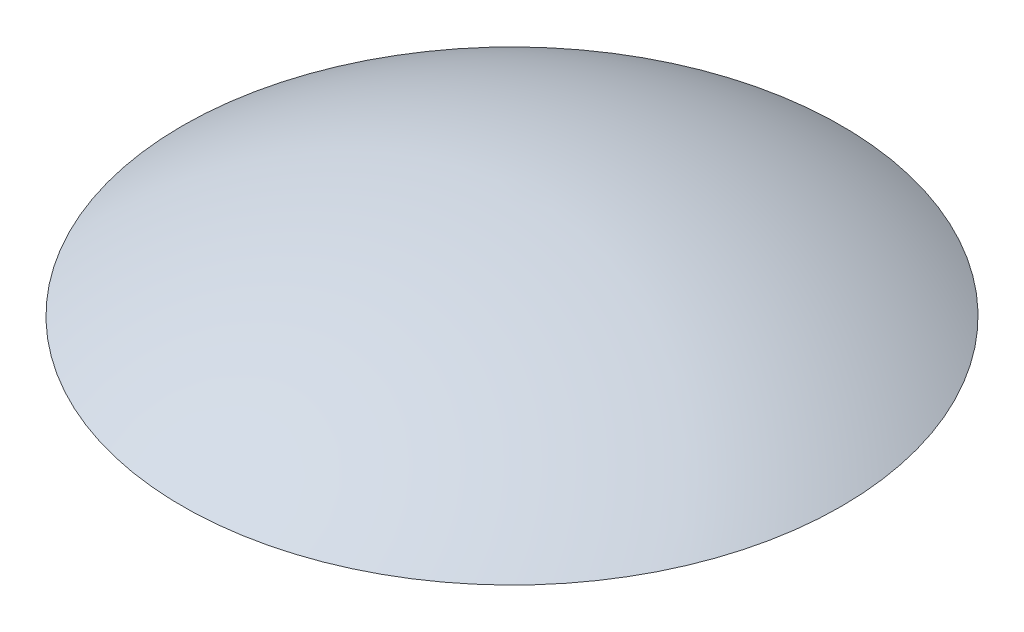
from build123d import *


with BuildPart() as part:
    # Sketch1 → Revolve4 (revolve)
    with BuildSketch(Plane.XY, mode=Mode.PRIVATE) as revolve4_sk:
        with BuildLine():
            Line((-101.651417422, 28.849797234), (-101.401417422, 28.849797234))
            Line((-101.401417422, 28.849797234), (-101.401417422, 28.924800828))
            ThreePointArc((-101.401417422, 28.924800828), (-101.53192177, 28.905645978), (-101.651417422, 28.849797234))
        make_face()
    revolve(revolve4_sk.sketch.rotate(Axis((-101.401417422, 28.849797234, 0), (0, 1, 0)), 180), axis=Axis((-101.401417422, 28.849797234, 0), (0, 1, 0)))


solid = part.part
